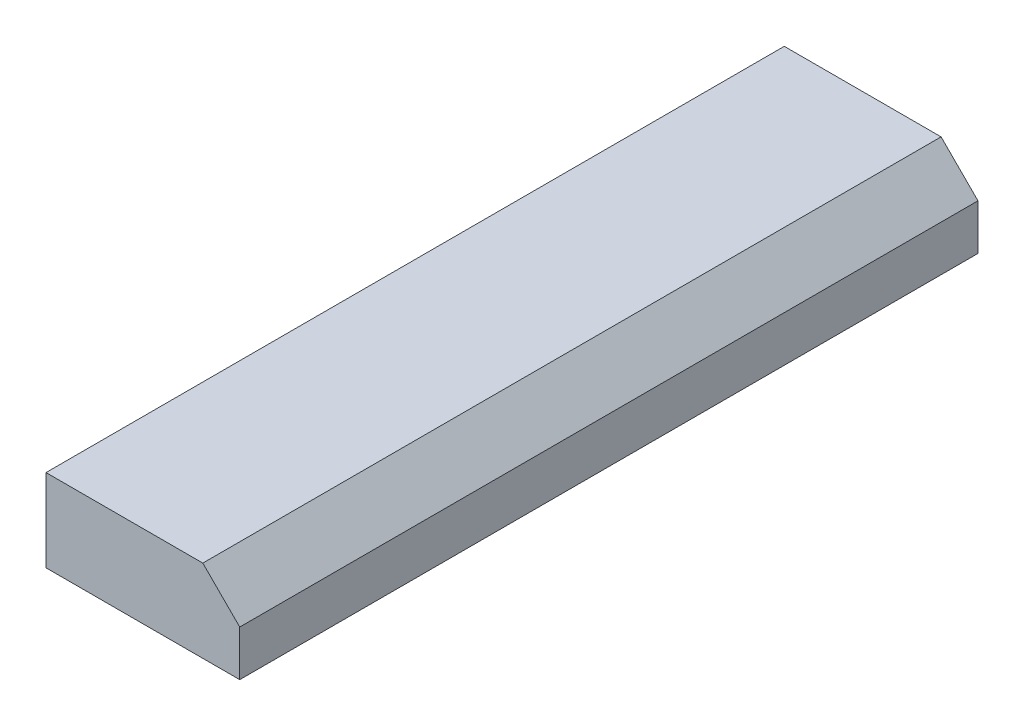
from build123d import *

# Parameters (mm, degrees)
SKIZZE1_W                       = 52.482326825
SKIZZE1_H                       = 22.353583648
AUFSATZ_LINEAR_AUSTRAGEN1_DEPTH = 200
FASE1_SIZE                      = 10


with BuildPart() as part:
    # Skizze1 → Aufsatz-Linear austragen1 (new body)
    with BuildSketch(Plane.XY):
        with Locations((-162.31044063, 135.449774465)):
            Rectangle(SKIZZE1_W, SKIZZE1_H)
    extrude(amount=AUFSATZ_LINEAR_AUSTRAGEN1_DEPTH)

    # Fase1
    fase1_edges = [part.edges().sort_by_distance(p)[0] for p in [
        (-136.069277217, 146.626566289, 100),
    ]]
    chamfer(fase1_edges, length=FASE1_SIZE)


solid = part.part
